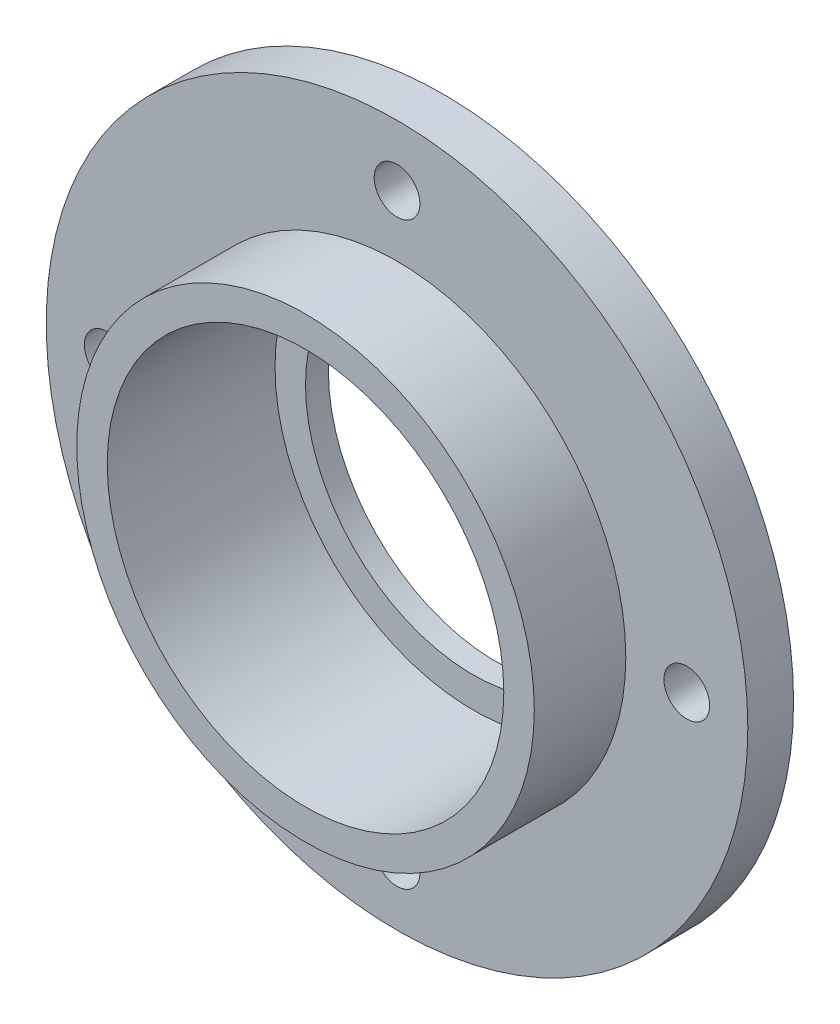
from build123d import *

# Parameters (mm, degrees)
BOSS_EXTRUDE1_DEPTH      = 7.5
BOSS_EXTRUDE1_DEPTH_BACK = 5
SKETCH1_R                = 15
SKETCH1_R_2              = 13
BOSS_EXTRUDE2_DEPTH      = 1.5
BOSS_EXTRUDE2_DEPTH_BACK = 1.5
SKETCH2_R                = 23
SKETCH2_R_2              = 15
SKETCH4_R                = 13
SKETCH4_R_2              = 11
BOSS_EXTRUDE3_DEPTH      = 1.5
SKETCH6_R                = 1.5
CUT_EXTRUDE1_DEPTH       = 10


with BuildPart() as part:
    # Sketch1 → Boss-Extrude1 (new, two sides: drawn at the far end of the back side and taken through both)
    with BuildSketch(Plane.XY.offset(-BOSS_EXTRUDE1_DEPTH_BACK)):
        Circle(SKETCH1_R)
        Circle(SKETCH1_R_2, mode=Mode.SUBTRACT)
    extrude(amount=BOSS_EXTRUDE1_DEPTH + BOSS_EXTRUDE1_DEPTH_BACK)

    # Sketch2 → Boss-Extrude2 (add, two sides: drawn at the far end of the back side and taken through both)
    with BuildSketch(Plane.XY.offset(-BOSS_EXTRUDE2_DEPTH_BACK)):
        Circle(SKETCH2_R)
        Circle(SKETCH2_R_2, mode=Mode.SUBTRACT)
    extrude(amount=BOSS_EXTRUDE2_DEPTH + BOSS_EXTRUDE2_DEPTH_BACK)

    # Sketch4 → Boss-Extrude3 (add)
    with BuildSketch(Plane(origin=(0, 0, -5), x_dir=(-1, 0, 0), z_dir=(0, 0, -1))):
        with Locations(Location((0, 0, 0), (0, 0, 180))):
            Circle(SKETCH4_R)
        Circle(SKETCH4_R_2, mode=Mode.SUBTRACT)
    extrude(amount=-BOSS_EXTRUDE3_DEPTH)

    # Sketch6 → Cut-Extrude1 (cut)
    with BuildSketch(Plane.XY.offset(1.5)):
        with Locations((0, 19)):
            Circle(SKETCH6_R)
        with Locations((19, 0)):
            Circle(SKETCH6_R)
        with Locations((0, -19)):
            Circle(SKETCH6_R)
        with Locations((-19, 0)):
            Circle(SKETCH6_R)
    extrude(amount=-CUT_EXTRUDE1_DEPTH, mode=Mode.SUBTRACT)


solid = part.part
